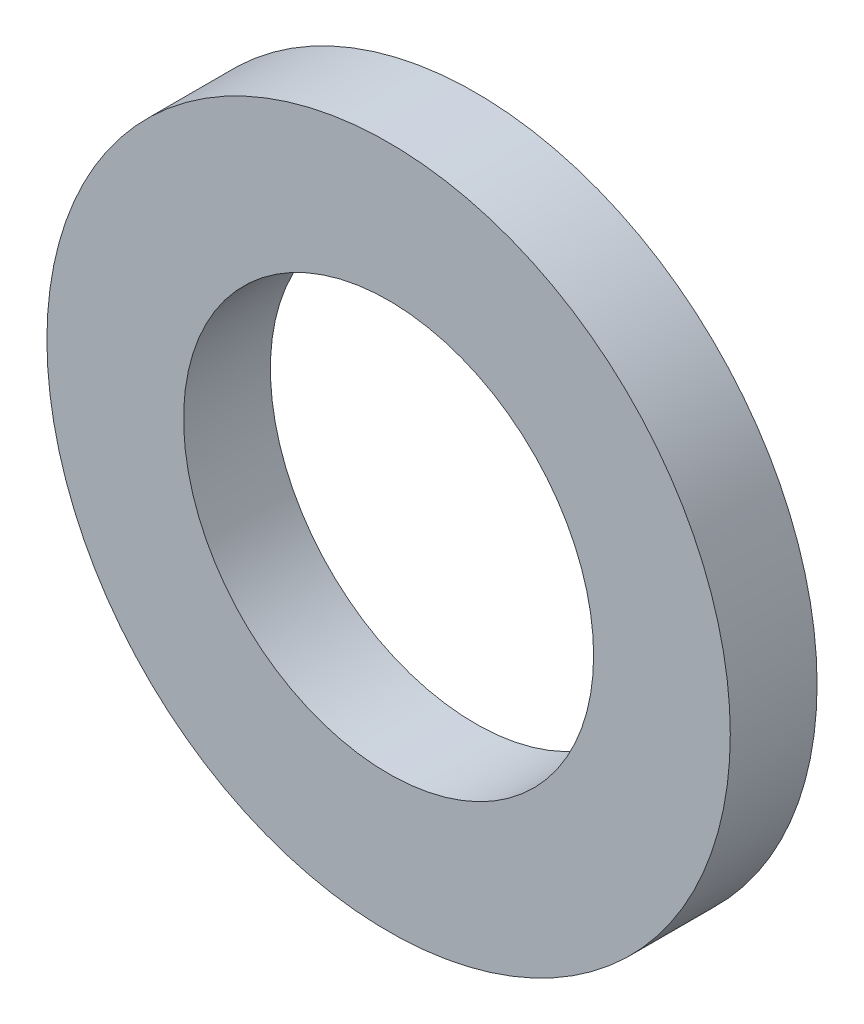
from build123d import *

# Parameters (mm, degrees)
SKETCH1_R           = 12.5
SKETCH1_R_2         = 7.5
BOSS_EXTRUDE1_DEPTH = 3.175


with BuildPart() as part:
    # Sketch1 → Boss-Extrude1 (new body)
    with BuildSketch(Plane.XY):
        Circle(SKETCH1_R)
        Circle(SKETCH1_R_2, mode=Mode.SUBTRACT)
    extrude(amount=BOSS_EXTRUDE1_DEPTH)


solid = part.part
